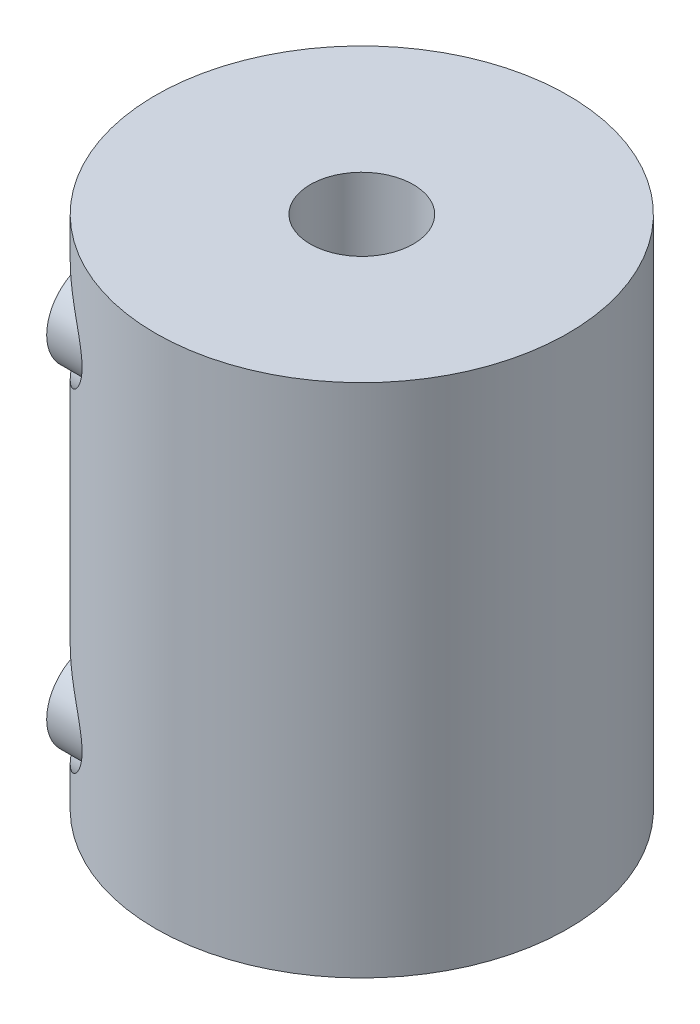
from build123d import *

# Parameters (mm, degrees)
SKETCH1_R           = 10
SKETCH1_R_2         = 2.5
BOSS_EXTRUDE1_DEPTH = 25
CUT_EXTRUDE1_START  = -4
SKETCH2_R           = 2.702701275
CUT_EXTRUDE1_DEPTH  = 25.722813233
SKETCH3_R           = 2.202701275
BOSS_EXTRUDE2_DEPTH = 3


with BuildPart() as part:
    # Sketch1 → Boss-Extrude1 (new body)
    with BuildSketch(Plane(origin=(0, 0, 0), x_dir=(1, 0, 0), z_dir=(0, 1, 0))):
        with Locations(Location((0, 0, 0), (0, 0, 270))):
            Circle(SKETCH1_R)
        with Locations(Location((0, 0, 0), (0, 0, 270))):
            Circle(SKETCH1_R_2, mode=Mode.SUBTRACT)
    extrude(amount=BOSS_EXTRUDE1_DEPTH)

    # Sketch2 → Cut-Extrude1 (cut, through all)
    with BuildSketch(Plane(origin=(0, 0, 0), x_dir=(0, 0, -1), z_dir=(1, 0, 0)).offset(CUT_EXTRUDE1_START)):
        with Locations((-6.078771431, 20.570801258)):
            Circle(SKETCH2_R)
        with Locations((-6.078771431, 4.429198742)):
            Circle(SKETCH2_R)
    extrude(amount=-CUT_EXTRUDE1_DEPTH, mode=Mode.SUBTRACT)

    # Sketch3 → Boss-Extrude2 (add)
    with BuildSketch(Plane.ZY.offset(4)):
        with Locations((6.078771431, 4.429198742)):
            Circle(SKETCH3_R)
        with Locations(Location((6.078771431, 20.570801258, 0), (0, 0, 180))):
            Circle(SKETCH3_R)
    extrude(amount=BOSS_EXTRUDE2_DEPTH)


solid = part.part
